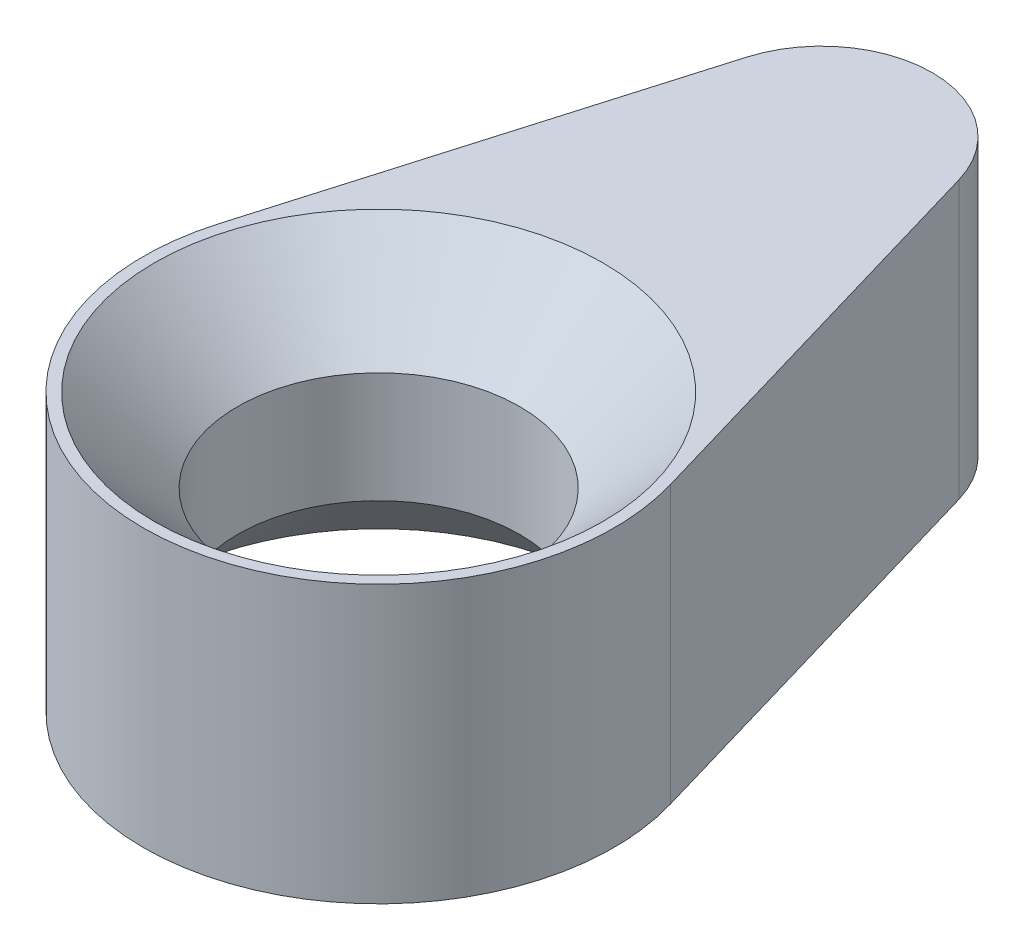
from build123d import *

# Parameters (mm, degrees)
SKETCH1_R           = 10.795
SKETCH1_R_2         = 6.477
BOSS_EXTRUDE1_DEPTH = 12.7
CHAMFER1_SIZE       = 3.81


with BuildPart() as part:
    # Sketch1 → Boss-Extrude1 (new body)
    # profile 1 of 2: a face of its own
    with BuildSketch(Plane(origin=(0, 0, 0), x_dir=(1, 0, 0), z_dir=(0, 1, 0))):
        with BuildLine():
            Line((-4.874943429, 21.74875), (-10.359254787, 3.03609375))
            ThreePointArc((-10.359254787, 3.03609375), (0, 10.795), (10.359254787, 3.03609375))
            Line((10.359254787, 3.03609375), (4.874943429, 21.74875))
            ThreePointArc((4.874943429, 21.74875), (0, 25.4), (-4.874943429, 21.74875))
        make_face()
    # profile 2 of 2: a face of its own
    with BuildSketch(Plane(origin=(0, 0, 0), x_dir=(1, 0, 0), z_dir=(0, 1, 0))):
        Circle(SKETCH1_R)
        with Locations(Location((0, 0, 0), (0, 0, 270))):
            Circle(SKETCH1_R_2, mode=Mode.SUBTRACT)
    extrude(amount=BOSS_EXTRUDE1_DEPTH)

    # Chamfer1
    chamfer1_edges = [part.edges().sort_by_distance(p)[0] for p in [
        (0, 12.7, -6.477),
        (0, 0, -6.477),
    ]]
    chamfer(chamfer1_edges, length=CHAMFER1_SIZE)


solid = part.part
